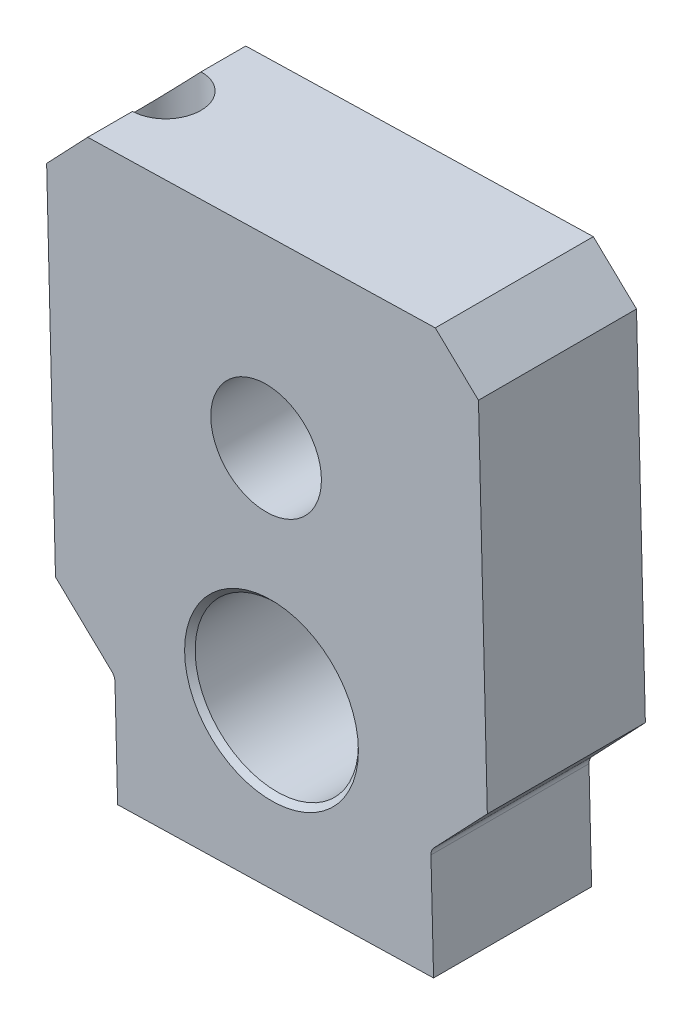
from build123d import *

# Parameters (mm, degrees)
SKETCH1_R           = 5.25
SKETCH1_R_2         = 7.75
BOSS_EXTRUDE2_DEPTH = 15
SKETCH3_R           = 11.15
CUT_EXTRUDE2_DEPTH  = 3
CHAMFER1_SIZE       = 4
CHAMFER2_SIZE       = 0.5
CUT_EXTRUDE3_REACH  = 61.876
SKETCH4_R           = 3.25


with BuildPart() as part:
    # Sketch1 → Boss-Extrude2 (new body)
    with BuildSketch(Plane.XY):
        with BuildLine():
            Line((20.995969439, -19.574054899), (20.05604274, 18.007086094))
            Line((20.05604274, 18.007086094), (-20.93113991, 16.981972267))
            Line((-20.93113991, 16.981972267), (-19.991213211, -20.599168727))
            Line((-19.991213211, -20.599168727), (-14.655542141, -25.674455545))
            ThreePointArc((-14.655542141, -25.674455545), (-14.430725672, -25.993357553), (-14.345060853, -26.374018128))
            Line((-14.345060853, -26.374018128), (-14.09521078, -36.363787386))
            Line((-14.09521078, -36.363787386), (15.895410672, -35.613704098))
            Line((15.895410672, -35.613704098), (15.645560598, -25.62393484))
            ThreePointArc((15.645560598, -25.62393484), (15.712089121, -25.239467818), (15.920682621, -24.90972597))
            Line((15.920682621, -24.90972597), (20.995969439, -19.574054899))
        make_face()
        Circle(SKETCH1_R, mode=Mode.SUBTRACT)
        with Locations((0.512556914, -20.493591325)):
            Circle(SKETCH1_R_2, mode=Mode.SUBTRACT)
    extrude(amount=BOSS_EXTRUDE2_DEPTH)

    # Sketch3 → Cut-Extrude2 (cut)
    with BuildSketch(Plane(origin=(0, 0, 0), x_dir=(-1, 0, 0), z_dir=(0, 0, -1))):
        Circle(SKETCH3_R)
    extrude(amount=-CUT_EXTRUDE2_DEPTH, mode=Mode.SUBTRACT)

    # Chamfer1
    chamfer1_edges = [part.edges().sort_by_distance(p)[0] for p in [
        (-20.93113991, 16.981972267, 7.5),
        (20.05604274, 18.007086094, 7.5),
    ]]
    chamfer(chamfer1_edges, length=CHAMFER1_SIZE)

    # Chamfer2
    chamfer2_edges = [part.edges().sort_by_distance(p)[0] for p in [
        (-7.237443086, -20.493591325, 0),
        (-7.237443086, -20.493591325, 15),
    ]]
    chamfer(chamfer2_edges, length=CHAMFER2_SIZE)

    # Cut-Extrude3: up to this plane
    cut_extrude3_end = Plane(origin=(-14.655542141, -25.674455545, 15), z_dir=(0.6892060940298353, 0.7245653593376775, 0))
    # Sketch4 → Cut-Extrude3 (cut, up to the surface)
    with BuildSketch(Plane(origin=(-0.437548585, 17.49452918, 0), x_dir=(0.9996873817241273, 0.02500277627702985, 0), z_dir=(-0.02500277627702985, 0.9996873817241273, 0)), mode=Mode.PRIVATE) as cut_extrude3_sk1:
        with Locations(Location((-16.5, -7.5, 0), (0, 0, 270))):
            Circle(SKETCH4_R)
    cut_extrude3_tool1 = split(extrude(cut_extrude3_sk1.sketch, amount=-CUT_EXTRUDE3_REACH, mode=Mode.PRIVATE), bisect_by=cut_extrude3_end, keep=Keep.BOTH, mode=Mode.PRIVATE)
    add(cut_extrude3_tool1.solids().sort_by_distance((-16.93239, 17.081983, 7.5))[0], mode=Mode.SUBTRACT)


solid = part.part
